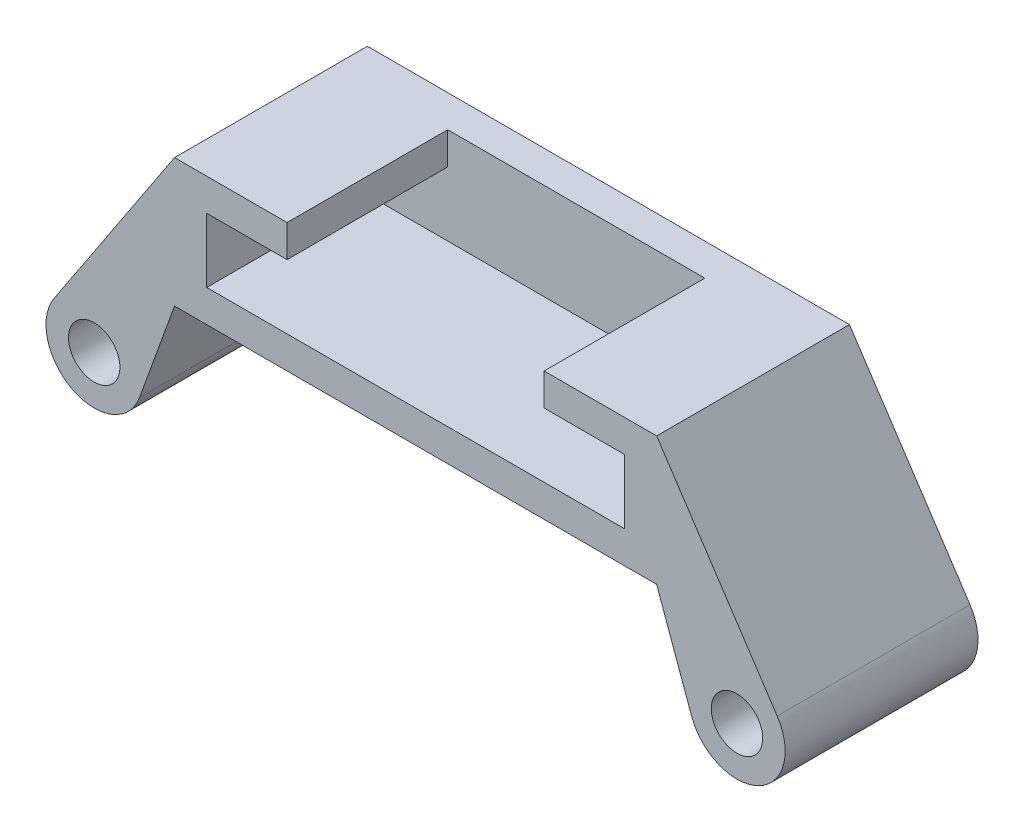
from build123d import *

# Parameters (mm, degrees)
SKETCH_1_R          = 1.6
EXTRUDE_1_DEPTH     = 12
CUT_EXTRUDE_1_DEPTH = 10


with BuildPart() as part:
    # Эскиз1 → Бобышка-Вытянуть1 (new body)
    with BuildSketch(Plane.XY):
        with BuildLine():
            Line((-57.947933857, 4.999983999), (-27.948022281, 4.999983999))
            Line((-27.948022281, 4.999983999), (-25.768907845, -1.020957985))
            ThreePointArc((-25.768907845, -1.020957985), (-21.600669135, -2.680440009), (-20.445626155, 1.654761283))
            Line((-20.445626155, 1.654761283), (-27.948022281, 12.999984004))
            Line((-27.948022281, 12.999984004), (-57.947933857, 12.999984004))
            Line((-57.947933857, 12.999984004), (-65.450329983, 1.654761282))
            ThreePointArc((-65.450329983, 1.654761282), (-64.295287003, -2.680440008), (-60.127048295, -1.020957985))
            Line((-60.127048295, -1.020957985), (-57.947933857, 4.999983999))
        make_face()
        with Locations((-62.947978069, 0)):
            Circle(SKETCH_1_R, mode=Mode.SUBTRACT)
        with Locations((-22.947978069, 0)):
            Circle(SKETCH_1_R, mode=Mode.SUBTRACT)
    extrude(amount=EXTRUDE_1_DEPTH)

    # Эскиз2 → Вырез-Вытянуть1 (cut)
    with BuildSketch(Plane.XY.offset(12)):
        Polygon((-42.947978069, 12.999984004), (-34.947978069, 12.999984004), (-34.947978069, 10.999984004), (-29.947978069, 10.999984004), (-29.947978069, 6.999984004), (-55.947978069, 6.999984004), (-55.947978069, 10.999984004), (-50.947978069, 10.999984004), (-50.947978069, 12.999984004), align=None)
    extrude(amount=-CUT_EXTRUDE_1_DEPTH, mode=Mode.SUBTRACT)


solid = part.part
